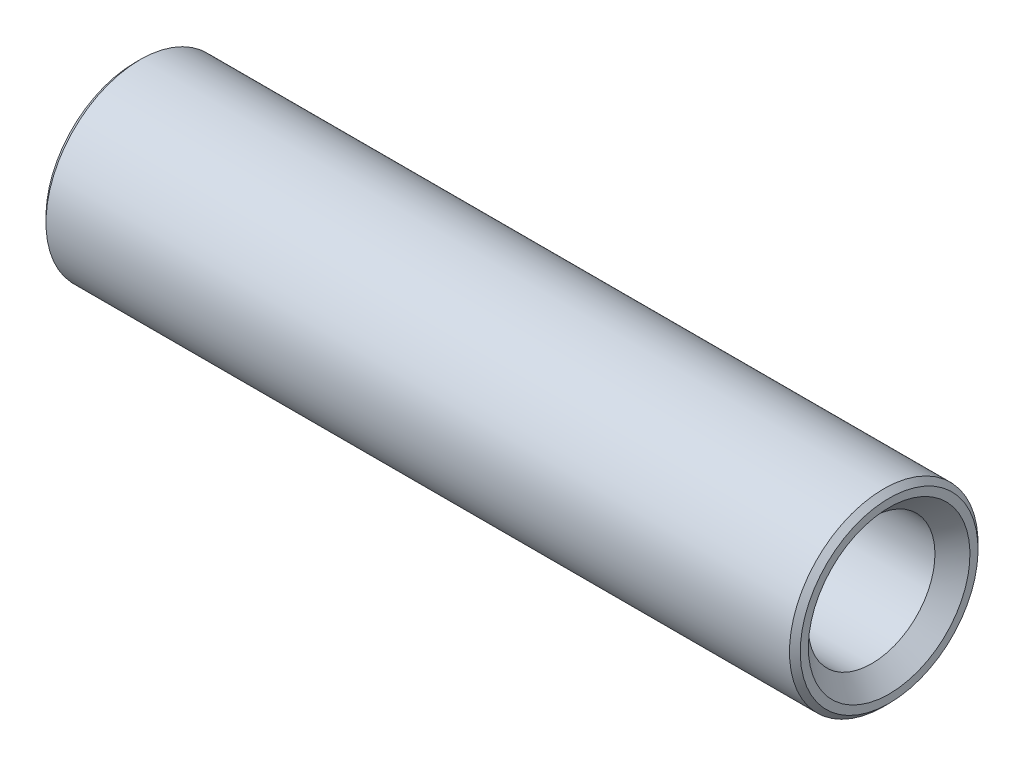
from build123d import *

# Parameters (mm, degrees)
CHAMFER1_SIZE = 0.2


with BuildPart() as part:
    # Sketch1 → Revolve1 (revolve)
    with BuildSketch(Plane.XY, mode=Mode.PRIVATE) as revolve1_sk:
        Polygon((-14, 3), (-13.35, 2.35), (13.35, 2.35), (14, 3), (14, 3.5), (-14, 3.5), align=None)
    revolve(revolve1_sk.sketch.rotate(Axis((-14, 0, 0), (1, 0, 0)), 180), axis=Axis((-14, 0, 0), (1, 0, 0)))

    # Chamfer1
    chamfer1_edges = [part.edges().sort_by_distance(p)[0] for p in [
        (-14, 3.5, 0),
        (14, 3.5, 0),
    ]]
    chamfer(chamfer1_edges, length=CHAMFER1_SIZE)


solid = part.part
